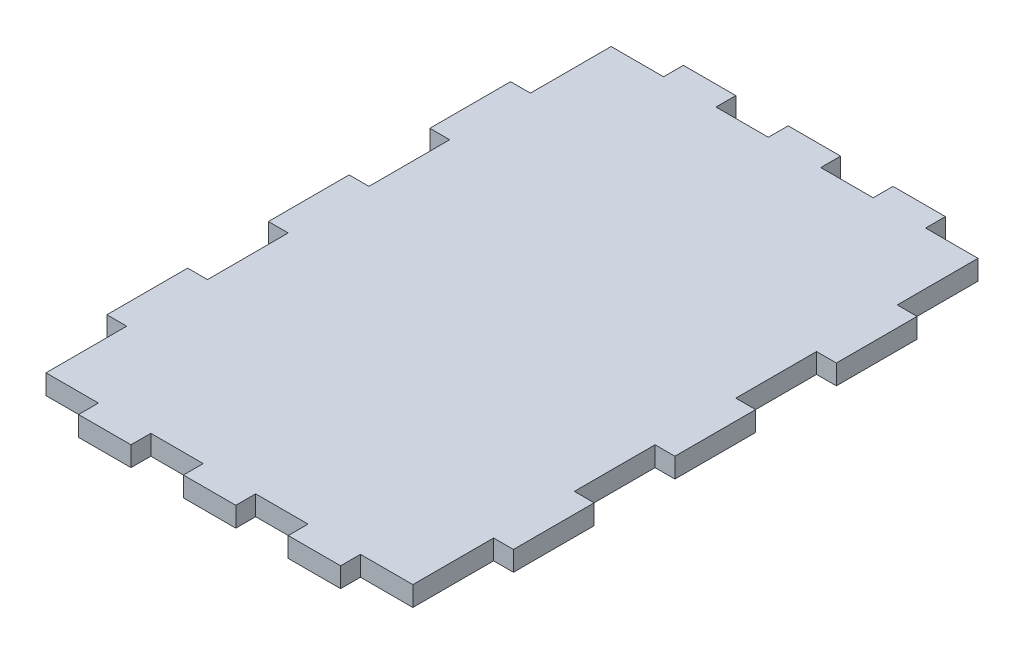
from build123d import *

# Parameters (mm, degrees)
SKETCH_4_W      = 37
SKETCH_4_H      = 57
EXTRUDE_1_DEPTH = 2
SKETCH_5_W      = 5.285714285
SKETCH_5_H      = 2
SKETCH_5_W_2    = 5.285714286
EXTRUDE_2_DEPTH = 2
EXTRUDE_START   = -57
SKETCH_5_3_W    = 5.285714285
SKETCH_5_3_H    = 2
SKETCH_5_3_W_2  = 5.285714286
EXTRUDE_3_DEPTH = 2
SKETCH_6_W      = 8.142857143
SKETCH_6_H      = 2
SKETCH_6_W_2    = 8.142857142
EXTRUDE_4_DEPTH = 2
EXTRUDE_START_2 = -37
SKETCH_6_2_W    = 8.142857143
SKETCH_6_2_H    = 2
SKETCH_6_2_W_2  = 8.142857142
EXTRUDE_5_DEPTH = 2


with BuildPart() as part:
    # 草图4 → 凸台-拉伸1 (new body)
    with BuildSketch(Plane(origin=(0, 0, 0), x_dir=(1, 0, 0), z_dir=(0, 1, 0))):
        Rectangle(SKETCH_4_W, SKETCH_4_H)
    extrude(amount=EXTRUDE_1_DEPTH)

    # 草图5 → 凸台-拉伸2 (add)
    with BuildSketch(Plane.XY.offset(28.5)):
        with Locations((10.571428572, 1)):
            Rectangle(SKETCH_5_W, SKETCH_5_H)
        with Locations((0, 1)):
            Rectangle(SKETCH_5_W_2, SKETCH_5_H)
        with Locations((-10.571428572, 1)):
            Rectangle(SKETCH_5_W, SKETCH_5_H)
    extrude(amount=EXTRUDE_2_DEPTH)

    # 草图5<3> → 凸台-拉伸3 (add)
    with BuildSketch(Plane.XY.offset(28.5).offset(EXTRUDE_START)):
        with Locations((10.571428572, 1)):
            Rectangle(SKETCH_5_3_W, SKETCH_5_3_H)
        with Locations((0, 1)):
            Rectangle(SKETCH_5_3_W_2, SKETCH_5_3_H)
        with Locations((-10.571428572, 1)):
            Rectangle(SKETCH_5_3_W, SKETCH_5_3_H)
    extrude(amount=-EXTRUDE_3_DEPTH)

    # 草图6 → 凸台-拉伸4 (add)
    with BuildSketch(Plane(origin=(18.5, 0, 0), x_dir=(0, 0, -1), z_dir=(1, 0, 0))):
        with Locations((-16.285714286, 1)):
            Rectangle(SKETCH_6_W, SKETCH_6_H)
        with Locations((0, 1)):
            Rectangle(SKETCH_6_W_2, SKETCH_6_H)
        with Locations((16.285714286, 1)):
            Rectangle(SKETCH_6_W, SKETCH_6_H)
    extrude(amount=EXTRUDE_4_DEPTH)

    # 草图6<2> → 凸台-拉伸5 (add)
    with BuildSketch(Plane(origin=(18.5, 0, 0), x_dir=(0, 0, -1), z_dir=(1, 0, 0)).offset(EXTRUDE_START_2)):
        with Locations((-16.285714286, 1)):
            Rectangle(SKETCH_6_2_W, SKETCH_6_2_H)
        with Locations((0, 1)):
            Rectangle(SKETCH_6_2_W_2, SKETCH_6_2_H)
        with Locations((16.285714286, 1)):
            Rectangle(SKETCH_6_2_W, SKETCH_6_2_H)
    extrude(amount=-EXTRUDE_5_DEPTH)


solid = part.part
